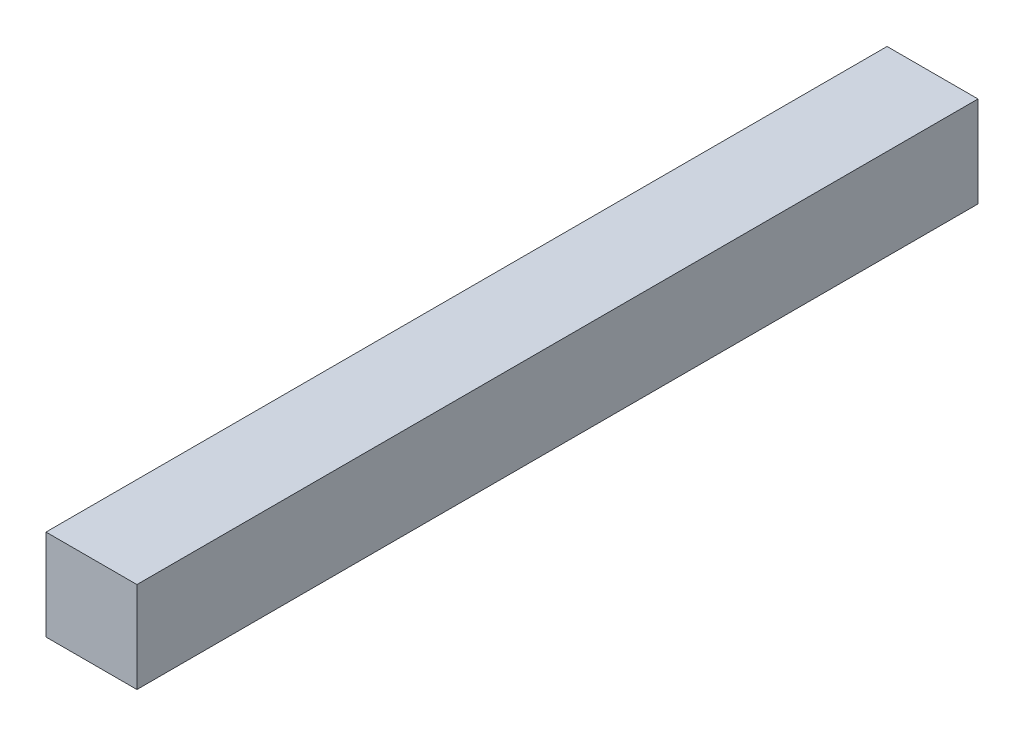
from build123d import *

# Parameters (mm, degrees)
SKETCH1_W           = 185
SKETCH1_H           = 20
BOSS_EXTRUDE1_DEPTH = 20
SKETCH2_W           = 0.610576924
SKETCH2_H           = 3.866987179
CUT_EXTRUDE1_DEPTH  = 4


with BuildPart() as part:
    # Sketch1 → Boss-Extrude1 (new body)
    with BuildSketch(Plane(origin=(0, 0, 0), x_dir=(0, 0, -1), z_dir=(1, 0, 0))):
        Rectangle(SKETCH1_W, SKETCH1_H)
    extrude(amount=BOSS_EXTRUDE1_DEPTH)

    # Sketch2 → Cut-Extrude1 (cut)
    # profile 1 of 7: a face of its own
    with BuildSketch(Plane(origin=(0, 0, 0), x_dir=(0, 0, -1), z_dir=(1, 0, 0))):
        Polygon((-11.668803419, 5.427350427), (-12.279380342, 5.427350427), (-12.279380342, 3.866987179), (-13.093482906, 3.866987179), (-13.093482906, 3.392094017), (-12.279380342, 3.392094017), (-12.279380342, 0), (-11.668803419, 0), (-11.668803419, 3.392094017), (-10.854700855, 3.392094017), (-10.854700855, 3.866987179), (-11.668803419, 3.866987179), align=None)
    # profile 2 of 7: a face of its own
    with BuildSketch(Plane(origin=(0, 0, 0), x_dir=(0, 0, -1), z_dir=(1, 0, 0))):
        with BuildLine():
            Line((-5.834401709, 5.427350427), (-6.444978632, 5.427350427))
            Line((-6.444978632, 5.427350427), (-6.444978632, 3.136626936))
            add(Edge.make_bspline(
                [(-6.444978632, 3.136626936), (-6.50446743, 3.200496063), (-6.621082042, 3.325697342), (-6.814846359, 3.487703852), (-7.015121254, 3.627202133), (-7.226069427, 3.739205359), (-7.445718681, 3.826800408), (-7.674626487, 3.889415018), (-7.912554135, 3.927467645), (-8.074104443, 3.932355358), (-8.155866052, 3.93482906)],
                knots=[0, 0, 0, 0, 1.07415008, 2.105633337, 3.103998732, 4.075565931, 5.040540589, 6.010859238, 6.993283574, 8, 8, 8, 8], degree=3))
            add(Edge.make_bspline(
                [(-8.155866052, 3.93482906), (-8.197939211, 3.934337126), (-8.280811772, 3.93336815), (-8.403234892, 3.922128741), (-8.522134061, 3.905280786), (-8.637727296, 3.88235118), (-8.749643662, 3.851419616), (-8.85780783, 3.812987353), (-8.962701105, 3.768628269), (-9.063529147, 3.718031271), (-9.158515741, 3.660350246), (-9.248646825, 3.599554702), (-9.331966613, 3.533332783), (-9.408622194, 3.462180231), (-9.478392946, 3.385644331), (-9.542435868, 3.305289996), (-9.598689045, 3.219345233), (-9.650590404, 3.128593488), (-9.695989496, 3.028065022), (-9.733494064, 2.915689145), (-9.764689312, 2.790384349), (-9.793037028, 2.652678599), (-9.811750447, 2.501273018), (-9.827089095, 2.337281871), (-9.835054619, 2.160417422), (-9.836384817, 2.038089349), (-9.83707265, 1.974834736)],
                knots=[0, 0, 0, 0, 1.021683283, 2.012435314, 2.983473585, 3.937869172, 4.872808728, 5.801185558, 6.724190829, 7.637729951, 8.538560957, 9.421760501, 10.276949778, 11.121084872, 11.959396615, 12.790471507, 13.614111827, 14.451940127, 15.327769077, 16.288588017, 17.325266595, 18.463133286, 19.701266581, 21.028475566, 22.463454662, 24, 24, 24, 24], degree=3))
            Line((-9.83707265, 1.974834736), (-9.83707265, 0))
            Line((-9.83707265, 0), (-9.226495726, 0))
            Line((-9.226495726, 0), (-9.226495726, 1.819010417))
            add(Edge.make_bspline(
                [(-9.226495726, 1.819010417), (-9.226357202, 1.871662121), (-9.226092212, 1.972382366), (-9.222336284, 2.116532517), (-9.219128621, 2.247366394), (-9.211072256, 2.364276534), (-9.203261136, 2.467583112), (-9.192519367, 2.557011842), (-9.180896966, 2.632986732), (-9.169210288, 2.678406458), (-9.163953993, 2.698834802)],
                knots=[0, 0, 0, 0, 1.429454469, 2.734479441, 3.915096125, 4.982083123, 5.9158061, 6.72734519, 7.427600459, 8, 8, 8, 8], degree=3))
            add(Edge.make_bspline(
                [(-9.163953993, 2.698834802), (-9.154515672, 2.729726568), (-9.136044927, 2.790181586), (-9.101141043, 2.876655997), (-9.058888628, 2.95653606), (-9.013259871, 3.031765724), (-8.960349257, 3.100068016), (-8.903336997, 3.162942351), (-8.839996459, 3.219586635), (-8.771264833, 3.270557736), (-8.69656975, 3.314614931), (-8.617441574, 3.354998099), (-8.531890729, 3.387028953), (-8.440786818, 3.413703066), (-8.344830204, 3.434776007), (-8.242835889, 3.449745892), (-8.135505977, 3.457864224), (-8.061889467, 3.459237149), (-8.024422409, 3.459935897)],
                knots=[0, 0, 0, 0, 1.040890899, 2.037017845, 2.999772166, 3.951073996, 4.869069183, 5.779972212, 6.683224964, 7.603478097, 8.53319658, 9.475456454, 10.463214634, 11.472278836, 12.533409461, 13.627045924, 14.792287113, 16, 16, 16, 16], degree=3))
            add(Edge.make_bspline(
                [(-8.024422409, 3.459935897), (-7.980924614, 3.459223869), (-7.895115583, 3.457819236), (-7.76786442, 3.443522416), (-7.644329819, 3.420099373), (-7.523388007, 3.388835222), (-7.407431279, 3.345549076), (-7.293409118, 3.2959497), (-7.183948992, 3.235227369), (-7.07808031, 3.166894898), (-6.979729281, 3.09071371), (-6.887512407, 3.011268091), (-6.804830686, 2.926541357), (-6.73143885, 2.83692262), (-6.666290592, 2.743691072), (-6.610930572, 2.645229123), (-6.564107073, 2.542696659), (-6.539800873, 2.471504885), (-6.527660924, 2.435947516)],
                knots=[0, 0, 0, 0, 1.077093923, 2.124806198, 3.16676328, 4.190026369, 5.214449133, 6.229293254, 7.267272823, 8.311139597, 9.347457364, 10.346171291, 11.324074378, 12.275494987, 13.212638205, 14.137563464, 15.069789411, 16, 16, 16, 16], degree=3))
            add(Edge.make_bspline(
                [(-6.527660924, 2.435947516), (-6.52096881, 2.410226644), (-6.50640323, 2.354244418), (-6.490418825, 2.261692315), (-6.474851795, 2.154351492), (-6.465932407, 2.031759), (-6.455340226, 1.894409359), (-6.44995401, 1.742364007), (-6.445152244, 1.575234639), (-6.44503823, 1.458958548), (-6.444978632, 1.398178753)],
                knots=[0, 0, 0, 0, 0.610940434, 1.329729645, 2.15826949, 3.104343598, 4.155103487, 5.326215764, 6.602360509, 8, 8, 8, 8], degree=3))
            Line((-6.444978632, 1.398178753), (-6.444978632, 0))
            Line((-6.444978632, 0), (-5.834401709, 0))
            Line((-5.834401709, 0), (-5.834401709, 5.427350427))
        make_face()
    # profile 3 of 7: a face of its own
    with BuildSketch(Plane(origin=(0, 0, 0), x_dir=(0, 0, -1), z_dir=(1, 0, 0))):
        with BuildLine():
            Line((-3.93482906, 3.866987179), (-4.545405983, 3.866987179))
            Line((-4.545405983, 3.866987179), (-4.545405983, 0.798202123))
            add(Edge.make_bspline(
                [(-4.545405983, 0.798202123), (-4.545240943, 0.732820739), (-4.544922304, 0.606590178), (-4.53570058, 0.424219199), (-4.52358332, 0.255523639), (-4.506078619, 0.100113642), (-4.481629768, -0.041307378), (-4.453184167, -0.169509355), (-4.420359952, -0.284409321), (-4.391589809, -0.354616076), (-4.377921341, -0.387970753)],
                knots=[0, 0, 0, 0, 1.301533202, 2.51284472, 3.634575474, 4.668610574, 5.625072911, 6.490366044, 7.282784772, 8, 8, 8, 8], degree=3))
            add(Edge.make_bspline(
                [(-4.377921341, -0.387970753), (-4.357908047, -0.43150625), (-4.318215534, -0.517850527), (-4.244060083, -0.639559609), (-4.158850333, -0.752835095), (-4.064194839, -0.859597429), (-3.958701949, -0.95843615), (-3.842628916, -1.049740083), (-3.71628201, -1.133778404), (-3.579402029, -1.208482713), (-3.433844145, -1.275489873), (-3.280248661, -1.333120952), (-3.120255776, -1.383754887), (-2.952315443, -1.422047516), (-2.778097855, -1.454448576), (-2.596079423, -1.475974205), (-2.407211999, -1.490518045), (-2.27873878, -1.491845597), (-2.213341346, -1.492521368)],
                knots=[0, 0, 0, 0, 0.892361144, 1.769826507, 2.649562032, 3.531070128, 4.425493976, 5.339743849, 6.280293132, 7.249898151, 8.242834287, 9.264015286, 10.305378017, 11.367518935, 12.471830068, 13.606296802, 14.781520001, 16, 16, 16, 16], degree=3))
            add(Edge.make_bspline(
                [(-2.213341346, -1.492521368), (-2.118207741, -1.491222444), (-1.932464228, -1.488686361), (-1.661715771, -1.459368849), (-1.405036427, -1.417709788), (-1.165299406, -1.354853383), (-0.943923682, -1.277825478), (-0.742570927, -1.189010091), (-0.562082597, -1.088747116), (-0.400546348, -0.972818082), (-0.254547455, -0.835114758), (-0.116222332, -0.673381421), (0.016523246, -0.484144733), (0.094888882, -0.344212293), (0.135683761, -0.271367521)],
                knots=[0, 0, 0, 0, 1.220149806, 2.382280289, 3.490641873, 4.554024904, 5.557741845, 6.495463758, 7.374449758, 8.202461232, 9.039706035, 9.943084277, 10.9292293, 12, 12, 12, 12], degree=3))
            Line((0.135683761, -0.271367521), (-0.474893162, -0.271367521))
            add(Edge.make_bspline(
                [(-0.474893162, -0.271367521), (-0.519447092, -0.332200691), (-0.607336708, -0.452203663), (-0.768684554, -0.605630443), (-0.946354299, -0.73614642), (-1.110064697, -0.823561811), (-1.250401876, -0.879066453), (-1.3622078, -0.916294976), (-1.480273133, -0.948509936), (-1.604756047, -0.972983278), (-1.735132133, -0.993883069), (-1.871802195, -1.006909284), (-2.014648444, -1.015679133), (-2.111917926, -1.016971013), (-2.161399907, -1.017628205)],
                knots=[0, 0, 0, 0, 1.406411641, 2.774367649, 4.13970867, 5.515970748, 6.226996413, 6.957671546, 7.716753095, 8.511703955, 9.326821042, 10.182754768, 11.075548767, 12, 12, 12, 12], degree=3))
            add(Edge.make_bspline(
                [(-2.161399907, -1.017628205), (-2.210174792, -1.016967501), (-2.306031196, -1.01566903), (-2.4467679, -1.00695501), (-2.581986706, -0.993670999), (-2.711035789, -0.973274657), (-2.834686878, -0.948191661), (-2.952121008, -0.916329046), (-3.063907787, -0.87905923), (-3.170008566, -0.837114713), (-3.268779764, -0.788992247), (-3.361461581, -0.73993744), (-3.445692506, -0.686163459), (-3.523321634, -0.630419363), (-3.593161156, -0.570873518), (-3.656404734, -0.509346702), (-3.711702665, -0.444382526), (-3.760820734, -0.375320979), (-3.802591958, -0.298451716), (-3.839004574, -0.211971478), (-3.867658355, -0.113540908), (-3.893534257, -0.004727454), (-3.911846901, 0.115847828), (-3.925884856, 0.247398647), (-3.932527519, 0.390378085), (-3.93404411, 0.489376067), (-3.93482906, 0.540614984)],
                knots=[0, 0, 0, 0, 1.284615551, 2.524631777, 3.71274724, 4.861840311, 5.964270962, 7.034369188, 8.064422103, 9.066774622, 10.036673369, 10.956946004, 11.82705178, 12.666609064, 13.47215512, 14.242132945, 14.988114445, 15.716233977, 16.470126793, 17.287679463, 18.182663732, 19.166922939, 20.231828452, 21.392172702, 22.650252828, 24, 24, 24, 24], degree=3))
            Line((-3.93482906, 0.540614984), (-3.93482906, 0.740960537))
            add(Edge.make_bspline(
                [(-3.93482906, 0.740960537), (-3.87814683, 0.683392198), (-3.764682515, 0.568154103), (-3.570599741, 0.419493126), (-3.35880585, 0.292036824), (-3.130743584, 0.186587921), (-2.890466092, 0.102589883), (-2.64061644, 0.044058671), (-2.383750669, 0.006196652), (-2.209941846, 0.002079111), (-2.122178819, 0)],
                knots=[0, 0, 0, 0, 0.9616226, 1.924939268, 2.903225655, 3.90145387, 4.913304235, 5.930317158, 6.954934346, 8, 8, 8, 8], degree=3))
            add(Edge.make_bspline(
                [(-2.122178819, 0), (-2.070561788, 0.000790342), (-1.96752531, 0.002368002), (-1.814373416, 0.015828452), (-1.663509749, 0.035391068), (-1.515288983, 0.064501341), (-1.369338277, 0.101178178), (-1.225937252, 0.14736591), (-1.084530786, 0.200183246), (-0.94640953, 0.261270977), (-0.813572503, 0.330030127), (-0.687324815, 0.403931861), (-0.568868102, 0.483705609), (-0.458713984, 0.569808161), (-0.355614619, 0.660723153), (-0.260702791, 0.757829721), (-0.173798187, 0.860484154), (-0.095359744, 0.96870809), (-0.025589435, 1.081180766), (0.036342233, 1.196181443), (0.087132601, 1.314965174), (0.129753477, 1.435587308), (0.162962534, 1.559251812), (0.185697156, 1.685874462), (0.201695624, 1.815069333), (0.202913557, 1.902350125), (0.203525641, 1.946213942)],
                knots=[0, 0, 0, 0, 1.102496069, 2.200771917, 3.282212953, 4.351067109, 5.425742796, 6.495236474, 7.567789237, 8.649230273, 9.719442957, 10.761602243, 11.772820946, 12.767879558, 13.746423923, 14.707251758, 15.666031455, 16.617263585, 17.559830464, 18.491849916, 19.404720472, 20.31668551, 21.223041296, 22.136535823, 23.063497827, 24, 24, 24, 24], degree=3))
            add(Edge.make_bspline(
                [(0.203525641, 1.946213942), (0.202316232, 1.990057992), (0.199901466, 2.077599234), (0.186343978, 2.207780616), (0.161926824, 2.335824583), (0.126189384, 2.460865557), (0.08319085, 2.584610186), (0.028838002, 2.70529273), (-0.035486579, 2.823628085), (-0.108155553, 2.939576686), (-0.189336155, 3.052031061), (-0.279828068, 3.157554607), (-0.376727249, 3.258246218), (-0.481656807, 3.351919996), (-0.593291509, 3.440917187), (-0.71354346, 3.521679971), (-0.839887467, 3.598957901), (-0.973752304, 3.667989443), (-1.112314876, 3.730050658), (-1.253000599, 3.78600366), (-1.396533994, 3.830621082), (-1.541136699, 3.87010409), (-1.688416472, 3.897647306), (-1.836875666, 3.919306883), (-1.987318684, 3.932431224), (-2.088232537, 3.934025045), (-2.13913929, 3.93482906)],
                knots=[0, 0, 0, 0, 0.927022606, 1.850940105, 2.763646773, 3.678917571, 4.597960441, 5.530863249, 6.473405952, 7.443374224, 8.422047587, 9.402429927, 10.379733957, 11.374159407, 12.373957143, 13.39539851, 14.434361868, 15.503500072, 16.57672747, 17.643462173, 18.701820727, 19.752719066, 20.810444757, 21.866850764, 22.923916819, 24, 24, 24, 24], degree=3))
            add(Edge.make_bspline(
                [(-2.13913929, 3.93482906), (-2.222629312, 3.932802344), (-2.387005517, 3.928812122), (-2.629226974, 3.896885248), (-2.862943058, 3.846722852), (-3.089552027, 3.773939584), (-3.310945221, 3.676107562), (-3.525826802, 3.544666571), (-3.736924345, 3.382916343), (-3.86753272, 3.25605441), (-3.93482906, 3.190688435)],
                knots=[0, 0, 0, 0, 1.000657623, 1.970107281, 2.924012196, 3.863137721, 4.818884552, 5.818573257, 6.876013614, 8, 8, 8, 8], degree=3))
            Line((-3.93482906, 3.190688435), (-3.93482906, 3.866987179))
        make_face()
        with BuildLine():
            add(Edge.make_bspline(
                [(-2.210161258, 3.459935897), (-2.130143012, 3.457569941), (-1.971654845, 3.452883807), (-1.738889872, 3.413127161), (-1.51399214, 3.351185846), (-1.301566206, 3.261705894), (-1.103065061, 3.153272129), (-0.926615579, 3.021084677), (-0.771307977, 2.871188034), (-0.64103998, 2.702440804), (-0.537170672, 2.52077092), (-0.4617408, 2.329599764), (-0.415498986, 2.130737444), (-0.409876119, 1.995216775), (-0.407051282, 1.927133413)],
                knots=[0, 0, 0, 0, 1.094811094, 2.168437986, 3.223641393, 4.281933969, 5.317030878, 6.312588996, 7.290981033, 8.263423301, 9.221049352, 10.146311928, 11.068737512, 12, 12, 12, 12], degree=3))
            add(Edge.make_bspline(
                [(-0.407051282, 1.927133413), (-0.408316407, 1.875798015), (-0.410807975, 1.77469683), (-0.435335487, 1.626606485), (-0.472569511, 1.485021349), (-0.527909707, 1.350808263), (-0.597842322, 1.223424763), (-0.683701784, 1.102963535), (-0.783713393, 0.988774438), (-0.89933017, 0.883462274), (-1.026784573, 0.787711331), (-1.163857487, 0.70332015), (-1.3108798, 0.633218842), (-1.466378454, 0.57459448), (-1.631739905, 0.530864528), (-1.805156161, 0.497374006), (-1.988192548, 0.478439903), (-2.113303202, 0.476093437), (-2.177300347, 0.474893162)],
                knots=[0, 0, 0, 0, 0.96111248, 1.892838345, 2.805071872, 3.698884346, 4.60559943, 5.522242918, 6.465191984, 7.44453383, 8.446901343, 9.448393885, 10.455190158, 11.494316124, 12.557523497, 13.656033041, 14.80100385, 16, 16, 16, 16], degree=3))
            add(Edge.make_bspline(
                [(-2.177300347, 0.474893162), (-2.241657208, 0.476069907), (-2.367836818, 0.47837706), (-2.552119595, 0.497719928), (-2.726947134, 0.52922646), (-2.891850791, 0.573877219), (-3.047511725, 0.630462546), (-3.192208348, 0.702822124), (-3.328689685, 0.784808658), (-3.453516529, 0.880747605), (-3.567040286, 0.985692883), (-3.664941215, 1.101082189), (-3.74830737, 1.22359181), (-3.816847204, 1.354013545), (-3.869990992, 1.492807329), (-3.908171141, 1.639578222), (-3.930764614, 1.794632507), (-3.933454357, 1.900557092), (-3.93482906, 1.954694177)],
                knots=[0, 0, 0, 0, 1.19578733, 2.34448939, 3.439297077, 4.493839214, 5.516052018, 6.51161546, 7.495918654, 8.470447695, 9.432171157, 10.363808737, 11.27629551, 12.180975096, 13.095609538, 14.032140546, 14.994245053, 16, 16, 16, 16], degree=3))
            add(Edge.make_bspline(
                [(-3.93482906, 1.954694177), (-3.932309676, 2.025220476), (-3.927377035, 2.1633022), (-3.884666631, 2.364589319), (-3.814344769, 2.553417301), (-3.716807721, 2.729588756), (-3.594754864, 2.891658864), (-3.446715643, 3.035281248), (-3.276351351, 3.161455925), (-3.084997546, 3.267433102), (-2.878714682, 3.35195289), (-2.663132627, 3.416081052), (-2.438927897, 3.452127062), (-2.286958271, 3.45731447), (-2.210161258, 3.459935897)],
                knots=[0, 0, 0, 0, 0.993273759, 1.944706513, 2.885586036, 3.824102814, 4.773434307, 5.734969173, 6.721162128, 7.75352746, 8.809825341, 9.857965814, 10.917534828, 12, 12, 12, 12], degree=3))
        make_face(mode=Mode.SUBTRACT)
    # profile 4 of 7: a face of its own
    with BuildSketch(Plane(origin=(0, 0, 0), x_dir=(0, 0, -1), z_dir=(1, 0, 0))):
        with BuildLine():
            add(Edge.make_bspline(
                [(1.596404247, 5.495192308), (1.562369243, 5.493815886), (1.496000333, 5.491131837), (1.400204774, 5.468756526), (1.313182685, 5.429515665), (1.235284081, 5.378176197), (1.169252876, 5.31645467), (1.120257204, 5.245930469), (1.090966644, 5.167680741), (1.08731747, 5.113466684), (1.085470085, 5.086020967)],
                knots=[0, 0, 0, 0, 1.126292746, 2.196292449, 3.23347918, 4.271985151, 5.273442343, 6.208143861, 7.092877767, 8, 8, 8, 8], degree=3))
            add(Edge.make_bspline(
                [(1.085470085, 5.086020967), (1.08735625, 5.059287203), (1.091106968, 5.006125968), (1.120260072, 4.929204932), (1.16961723, 4.859738512), (1.235240766, 4.798073789), (1.313194435, 4.746775084), (1.400201537, 4.707523129), (1.496001203, 4.685150858), (1.562369538, 4.682466384), (1.596404247, 4.681089744)],
                knots=[0, 0, 0, 0, 0.888755228, 1.767327854, 2.697484928, 3.7044632, 4.748694502, 5.79159929, 6.86749795, 8, 8, 8, 8], degree=3))
            add(Edge.make_bspline(
                [(1.596404247, 4.681089744), (1.629736206, 4.682477743), (1.695060171, 4.685197943), (1.789721548, 4.707730871), (1.876461266, 4.7467425), (1.954299638, 4.798137952), (2.020166238, 4.859392655), (2.06814768, 4.929554635), (2.097519081, 5.006086229), (2.101231424, 5.059273906), (2.103098291, 5.086020967)],
                knots=[0, 0, 0, 0, 1.114826149, 2.184835993, 3.233187219, 4.282871886, 5.295108974, 6.223442501, 7.10660336, 8, 8, 8, 8], degree=3))
            add(Edge.make_bspline(
                [(2.103098291, 5.086020967), (2.101270898, 5.113480249), (2.097661214, 5.1677211), (2.068145636, 5.245582737), (2.0205314, 5.316795577), (1.954256771, 5.378113213), (1.876472899, 5.429547933), (1.789718381, 5.468548898), (1.695061009, 5.491084712), (1.629736489, 5.493804513), (1.596404247, 5.495192308)],
                knots=[0, 0, 0, 0, 0.911825585, 1.801146763, 2.734119375, 3.740769039, 4.784659576, 5.827224033, 6.891327554, 8, 8, 8, 8], degree=3))
        make_face()
    # profile 5 of 7: a face of its own
    with BuildSketch(Plane(origin=(0, 0, 0), x_dir=(0, 0, -1), z_dir=(1, 0, 0))):
        with Locations((1.594284188, 1.93349359)):
            Rectangle(SKETCH2_W, SKETCH2_H)
    # profile 6 of 7: a face of its own
    with BuildSketch(Plane(origin=(0, 0, 0), x_dir=(0, 0, -1), z_dir=(1, 0, 0))):
        with BuildLine():
            Line((3.553218483, 1.221153846), (3.052884615, 0.999607706))
            add(Edge.make_bspline(
                [(3.052884615, 0.999607706), (3.093826014, 0.939760858), (3.174137387, 0.82236422), (3.311402465, 0.663521119), (3.455029765, 0.519607698), (3.611526045, 0.39645767), (3.776842163, 0.288866302), (3.951599523, 0.195531876), (4.135645569, 0.114445632), (4.330533531, 0.0473694), (4.537290907, -0.004546296), (4.756346154, -0.041184023), (4.98837163, -0.063892228), (5.147448759, -0.066501951), (5.229124933, -0.06784188)],
                knots=[0, 0, 0, 0, 1.028550373, 2.01762266, 2.975264797, 3.910578725, 4.838520313, 5.772057253, 6.71983626, 7.690602934, 8.69423223, 9.742300095, 10.840812058, 12, 12, 12, 12], degree=3))
            add(Edge.make_bspline(
                [(5.229124933, -0.06784188), (5.319307115, -0.066109105), (5.49520015, -0.062729468), (5.751552053, -0.033580329), (5.993191508, 0.01363379), (6.219864335, 0.080141521), (6.431296826, 0.16632434), (6.627491987, 0.271765767), (6.808965713, 0.395949267), (6.971926107, 0.539531709), (7.118435672, 0.693115996), (7.24636626, 0.853938635), (7.35554029, 1.019545631), (7.44359107, 1.19111545), (7.513513081, 1.366626854), (7.562189118, 1.547678814), (7.593154759, 1.733491141), (7.596572259, 1.859523496), (7.598290598, 1.922893296)],
                knots=[0, 0, 0, 0, 1.253497118, 2.444844522, 3.581709244, 4.67290735, 5.723851329, 6.750306004, 7.764127638, 8.773906301, 9.764221974, 10.711745802, 11.627392092, 12.517240337, 13.388450951, 14.248888345, 15.119530894, 16, 16, 16, 16], degree=3))
            add(Edge.make_bspline(
                [(7.598290598, 1.922893296), (7.59671556, 1.982354114), (7.593588367, 2.100411866), (7.566867801, 2.274599766), (7.526168406, 2.444707285), (7.465875936, 2.609046908), (7.39062724, 2.7691327), (7.297188447, 2.923372135), (7.188325968, 3.0737452), (7.103829209, 3.166722517), (7.060855702, 3.214009081)],
                knots=[0, 0, 0, 0, 0.994594993, 1.974739895, 2.942858905, 3.917440094, 4.898815115, 5.898775058, 6.931355414, 8, 8, 8, 8], degree=3))
            add(Edge.make_bspline(
                [(7.060855702, 3.214009081), (7.002645749, 3.271464746), (6.887005125, 3.385606891), (6.694139039, 3.533388608), (6.486005186, 3.657250089), (6.264102518, 3.759542223), (6.026955833, 3.83733269), (5.776710376, 3.895500102), (5.511234027, 3.927837366), (5.329557741, 3.932461597), (5.236545139, 3.93482906)],
                knots=[0, 0, 0, 0, 0.971468177, 1.929930888, 2.87924043, 3.845173235, 4.827968633, 5.840649589, 6.894479818, 8, 8, 8, 8], degree=3))
            add(Edge.make_bspline(
                [(5.236545139, 3.93482906), (5.140663123, 3.932823089), (4.953486051, 3.928907113), (4.680272176, 3.8915166), (4.421955247, 3.833000187), (4.178041392, 3.749828125), (3.948823046, 3.642531936), (3.73503927, 3.510244405), (3.535521902, 3.354782876), (3.416970892, 3.234473586), (3.357113048, 3.173727965)],
                knots=[0, 0, 0, 0, 1.100780758, 2.148900583, 3.160985341, 4.138993548, 5.103074933, 6.061595952, 7.02127625, 8, 8, 8, 8], degree=3))
            add(Edge.make_bspline(
                [(3.357113048, 3.173727965), (3.316966186, 3.128189569), (3.237513293, 3.038066525), (3.135067629, 2.890272562), (3.04939461, 2.733902166), (2.977879413, 2.569691936), (2.921266383, 2.397309485), (2.881654719, 2.216135335), (2.855182974, 2.02683373), (2.851323541, 1.897543425), (2.849358974, 1.831730769)],
                knots=[0, 0, 0, 0, 0.991024859, 1.961293861, 2.930016615, 3.899340981, 4.883129092, 5.888537453, 6.925202031, 8, 8, 8, 8], degree=3))
            Line((2.849358974, 1.831730769), (6.987713675, 1.831730769))
            add(Edge.make_bspline(
                [(6.987713675, 1.831730769), (6.984960399, 1.78072443), (6.979533408, 1.680185691), (6.951963737, 1.533626771), (6.912523044, 1.393375287), (6.855299734, 1.26159147), (6.785075434, 1.135933996), (6.698549356, 1.01846446), (6.597988389, 0.907381031), (6.484337592, 0.804461153), (6.359276437, 0.711282645), (6.225984592, 0.630137554), (6.085888827, 0.56005505), (5.938330857, 0.504380012), (5.783425383, 0.460292405), (5.621511075, 0.430613808), (5.452592922, 0.410361206), (5.337663499, 0.408170506), (5.278946314, 0.407051282)],
                knots=[0, 0, 0, 0, 0.989560905, 1.9505263, 2.8851385, 3.809141245, 4.729580329, 5.671124297, 6.631674319, 7.630937612, 8.639554004, 9.651353955, 10.653385491, 11.672697909, 12.705190456, 13.77221026, 14.861827209, 16, 16, 16, 16], degree=3))
            add(Edge.make_bspline(
                [(5.278946314, 0.407051282), (5.221664788, 0.407997018), (5.107553808, 0.409881026), (4.93785124, 0.427291264), (4.770496172, 0.456336038), (4.606868374, 0.495021102), (4.45006171, 0.542853107), (4.304764223, 0.600382893), (4.171256406, 0.663942168), (4.046604986, 0.736446393), (3.925860634, 0.825635413), (3.805374155, 0.936845679), (3.677901231, 1.069003494), (3.596306793, 1.168573183), (3.553218483, 1.221153846)],
                knots=[0, 0, 0, 0, 1.038720112, 2.069242521, 3.090194857, 4.117703715, 5.117086279, 6.060835234, 6.949442673, 7.796883902, 8.672359865, 9.666054705, 10.767492468, 12, 12, 12, 12], degree=3))
        make_face()
        with BuildLine():
            add(Edge.make_bspline(
                [(3.459935897, 2.306623932), (3.4807785, 2.369721631), (3.521071517, 2.491702397), (3.602715099, 2.659877627), (3.695558079, 2.8096274), (3.806232094, 2.938913748), (3.932348573, 3.052708895), (4.075781202, 3.154000519), (4.237868428, 3.242790577), (4.415960306, 3.318850377), (4.604525886, 3.382765798), (4.801109518, 3.426457997), (5.002098673, 3.455784315), (5.13821015, 3.458543948), (5.206864316, 3.459935897)],
                knots=[0, 0, 0, 0, 1.059200688, 2.047651669, 2.975137365, 3.863037386, 4.753100469, 5.679145756, 6.658227321, 7.696087836, 8.765769263, 9.829790172, 10.905353532, 12, 12, 12, 12], degree=3))
            add(Edge.make_bspline(
                [(5.206864316, 3.459935897), (5.263086738, 3.4590198), (5.373678124, 3.457217807), (5.53639122, 3.439965371), (5.6928164, 3.410906339), (5.844011162, 3.372648904), (5.987968291, 3.319603134), (6.127259017, 3.258469995), (6.259802608, 3.184262621), (6.342960031, 3.126366561), (6.384556958, 3.097405849)],
                knots=[0, 0, 0, 0, 1.076055584, 2.116637343, 3.127623239, 4.120225418, 5.098058948, 6.060968605, 7.030059552, 8, 8, 8, 8], degree=3))
            add(Edge.make_bspline(
                [(6.384556958, 3.097405849), (6.413988143, 3.074621749), (6.473279033, 3.028721812), (6.554462769, 2.949492755), (6.63128223, 2.863313477), (6.702941303, 2.768753504), (6.76663468, 2.664133283), (6.827524874, 2.553213149), (6.882045791, 2.433430368), (6.912658642, 2.34959919), (6.92835203, 2.306623932)],
                knots=[0, 0, 0, 0, 0.916062907, 1.845463751, 2.788616269, 3.758101748, 4.762692155, 5.802440563, 6.873442008, 8, 8, 8, 8], degree=3))
            Line((6.92835203, 2.306623932), (3.459935897, 2.306623932))
        make_face(mode=Mode.SUBTRACT)
    # profile 7 of 7: a face of its own
    with BuildSketch(Plane(origin=(0, 0, 0), x_dir=(0, 0, -1), z_dir=(1, 0, 0))):
        with BuildLine():
            Line((12.686431624, 5.427350427), (12.075854701, 5.427350427))
            Line((12.075854701, 5.427350427), (12.075854701, 3.136626936))
            add(Edge.make_bspline(
                [(12.075854701, 3.136626936), (12.016365904, 3.200496063), (11.899751292, 3.325697342), (11.705986974, 3.487703852), (11.505712079, 3.627202133), (11.294763906, 3.739205359), (11.075114652, 3.826800408), (10.846206847, 3.889415018), (10.608279198, 3.927467645), (10.44672889, 3.932355358), (10.364967281, 3.93482906)],
                knots=[0, 0, 0, 0, 1.07415008, 2.105633337, 3.103998732, 4.075565931, 5.040540589, 6.010859238, 6.993283574, 8, 8, 8, 8], degree=3))
            add(Edge.make_bspline(
                [(10.364967281, 3.93482906), (10.322894122, 3.934337126), (10.240021562, 3.93336815), (10.117598441, 3.922128741), (9.998699272, 3.905280786), (9.883106038, 3.88235118), (9.771189671, 3.851419616), (9.663025503, 3.812987353), (9.558132228, 3.768628269), (9.457304186, 3.718031271), (9.362317592, 3.660350246), (9.272186508, 3.599554702), (9.18886672, 3.533332783), (9.112211139, 3.462180231), (9.042440387, 3.385644331), (8.978397466, 3.305289996), (8.922144288, 3.219345233), (8.87024293, 3.128593488), (8.824843837, 3.028065022), (8.787339269, 2.915689145), (8.756144022, 2.790384349), (8.727796306, 2.652678599), (8.709082887, 2.501273018), (8.693744238, 2.337281871), (8.685778714, 2.160417422), (8.684448516, 2.038089349), (8.683760684, 1.974834736)],
                knots=[0, 0, 0, 0, 1.021683283, 2.012435314, 2.983473585, 3.937869172, 4.872808728, 5.801185558, 6.724190829, 7.637729951, 8.538560957, 9.421760501, 10.276949778, 11.121084872, 11.959396615, 12.790471507, 13.614111827, 14.451940127, 15.327769077, 16.288588017, 17.325266595, 18.463133286, 19.701266581, 21.028475566, 22.463454662, 24, 24, 24, 24], degree=3))
            Line((8.683760684, 1.974834736), (8.683760684, 0))
            Line((8.683760684, 0), (9.294337607, 0))
            Line((9.294337607, 0), (9.294337607, 1.819010417))
            add(Edge.make_bspline(
                [(9.294337607, 1.819010417), (9.294476131, 1.871662121), (9.294741121, 1.972382366), (9.298497049, 2.116532517), (9.301704713, 2.247366394), (9.309761077, 2.364276534), (9.317572197, 2.467583112), (9.328313967, 2.557011842), (9.339936368, 2.632986732), (9.351623045, 2.678406458), (9.35687934, 2.698834802)],
                knots=[0, 0, 0, 0, 1.429454469, 2.734479441, 3.915096125, 4.982083123, 5.9158061, 6.72734519, 7.427600459, 8, 8, 8, 8], degree=3))
            add(Edge.make_bspline(
                [(9.35687934, 2.698834802), (9.366317662, 2.729726568), (9.384788406, 2.790181586), (9.41969229, 2.876655997), (9.461944705, 2.95653606), (9.507573462, 3.031765724), (9.560484076, 3.100068016), (9.617496336, 3.162942351), (9.680836874, 3.219586635), (9.749568501, 3.270557736), (9.824263583, 3.314614931), (9.90339176, 3.354998099), (9.988942605, 3.387028953), (10.080046516, 3.413703066), (10.17600313, 3.434776007), (10.277997445, 3.449745892), (10.385327357, 3.457864224), (10.458943866, 3.459237149), (10.496410924, 3.459935897)],
                knots=[0, 0, 0, 0, 1.040890899, 2.037017845, 2.999772166, 3.951073996, 4.869069183, 5.779972212, 6.683224964, 7.603478097, 8.53319658, 9.475456454, 10.463214634, 11.472278836, 12.533409461, 13.627045924, 14.792287113, 16, 16, 16, 16], degree=3))
            add(Edge.make_bspline(
                [(10.496410924, 3.459935897), (10.53990872, 3.459223869), (10.625717751, 3.457819236), (10.752968913, 3.443522416), (10.876503515, 3.420099373), (10.997445326, 3.388835222), (11.113402055, 3.345549076), (11.227424215, 3.2959497), (11.336884342, 3.235227369), (11.442753023, 3.166894898), (11.541104052, 3.09071371), (11.633320926, 3.011268091), (11.716002647, 2.926541357), (11.789394484, 2.83692262), (11.854542742, 2.743691072), (11.909902762, 2.645229123), (11.95672626, 2.542696659), (11.98103246, 2.471504885), (11.993172409, 2.435947516)],
                knots=[0, 0, 0, 0, 1.077093923, 2.124806198, 3.16676328, 4.190026369, 5.214449133, 6.229293254, 7.267272823, 8.311139597, 9.347457364, 10.346171291, 11.324074378, 12.275494987, 13.212638205, 14.137563464, 15.069789411, 16, 16, 16, 16], degree=3))
            add(Edge.make_bspline(
                [(11.993172409, 2.435947516), (11.999864523, 2.410226644), (12.014430104, 2.354244418), (12.030414509, 2.261692315), (12.045981539, 2.154351492), (12.054900926, 2.031759), (12.065493108, 1.894409359), (12.070879323, 1.742364007), (12.075681089, 1.575234639), (12.075795103, 1.458958548), (12.075854701, 1.398178753)],
                knots=[0, 0, 0, 0, 0.610940434, 1.329729645, 2.15826949, 3.104343598, 4.155103487, 5.326215764, 6.602360509, 8, 8, 8, 8], degree=3))
            Line((12.075854701, 1.398178753), (12.075854701, 0))
            Line((12.075854701, 0), (12.686431624, 0))
            Line((12.686431624, 0), (12.686431624, 5.427350427))
        make_face()
    extrude(amount=CUT_EXTRUDE1_DEPTH, mode=Mode.SUBTRACT)


solid = part.part
